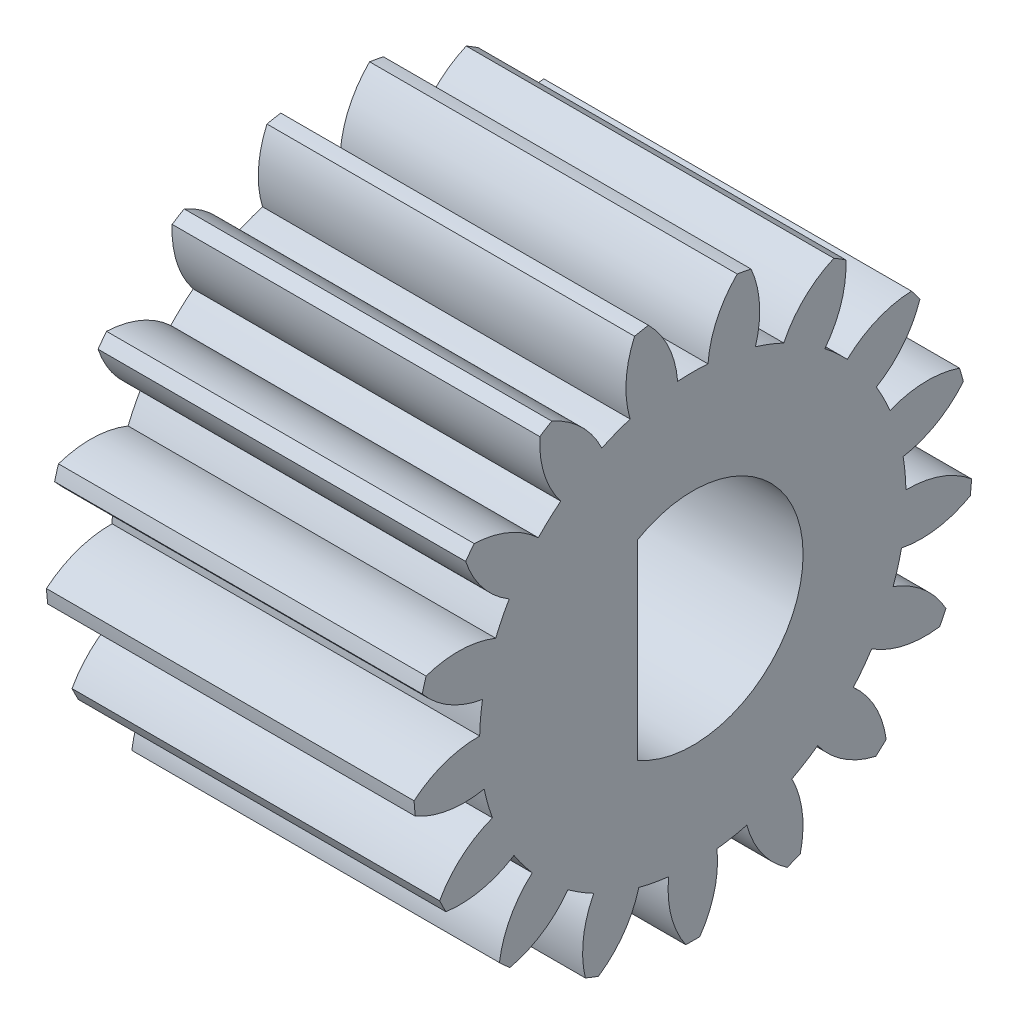
from build123d import *

# Parameters (mm, degrees)
BASPROSKE_W         = 10
BASPROSKE_H         = 7.6
TOOTHCUT_DEPTH      = 15.680599443
TEETHCUTS_COUNT     = 17
TEETHCUTS_ANGLE     = 338.823529412
BORSKE_R            = 3
BORE_DEPTH          = 50.0001016
BOSS_EXTRUDE3_DEPTH = 10


with BuildPart() as part:
    # BasProSke → Base-Revolve (revolve)
    with BuildSketch(Plane(origin=(0, 0, 0), x_dir=(1, 0, 0), z_dir=(0, 1, 0)), mode=Mode.PRIVATE) as base_revolve_sk:
        with Locations((5, 3.8)):
            Rectangle(BASPROSKE_W, BASPROSKE_H)
    revolve(base_revolve_sk.sketch.rotate(Axis((-10, 0, 0), (1, 0, 0)), 180), axis=Axis((-10, 0, 0), (1, 0, 0)))

    # TooCutSke → ToothCut (cut, through all)
    with BuildSketch(Plane(origin=(0, 0, 0), x_dir=(0, 0, -1), z_dir=(1, 0, 0))):
        with BuildLine():
            ThreePointArc((0.412875903, 5.784283403), (0, 5.799), (-0.412875903, 5.784283403))
            ThreePointArc((-0.412875903, 5.784283403), (-0.662486036, 6.729558143), (-1.230208712, 7.525510726))
            ThreePointArc((-1.230208712, 7.525510726), (0, 7.6254), (1.230208712, 7.525510726))
            ThreePointArc((1.230208712, 7.525510726), (0.662486036, 6.729558143), (0.412875903, 5.784283403))
        make_face()
    toothcut = extrude(amount=TOOTHCUT_DEPTH, mode=Mode.SUBTRACT)

    # TeethCuts: ToothCut ×17 about axis
    teethcuts_axis = Axis((-10, 0, 0), (1, 0, 0))
    for i in range(1, TEETHCUTS_COUNT):
        add(toothcut.rotate(teethcuts_axis, i * TEETHCUTS_ANGLE / (TEETHCUTS_COUNT - 1)), mode=Mode.SUBTRACT)

    # BorSke → Bore (cut, symmetric)
    with BuildSketch(Plane(origin=(0, 0, 0), x_dir=(0, 0, -1), z_dir=(1, 0, 0))):
        with Locations(Location((0, 0, 0), (0, 0, 180))):
            Circle(BORSKE_R)
    extrude(amount=BORE_DEPTH, both=True, mode=Mode.SUBTRACT)

    # Sketch1 → Boss-Extrude3 (add)
    with BuildSketch(Plane(origin=(10, 0, 0), x_dir=(0, 0, -1), z_dir=(1, 0, 0))):
        with BuildLine():
            ThreePointArc((-1.5, 2.598076211), (-2.598076211, 1.5), (-3, 0))
            Line((-3, 0), (-1.5, 0))
            Line((-1.5, 0), (-1.5, 2.598076211))
        make_face()
        with BuildLine():
            Line((-1.5, 0), (-3, 0))
            ThreePointArc((-3, 0), (-2.598076211, -1.5), (-1.5, -2.598076211))
            Line((-1.5, -2.598076211), (-1.5, 0))
        make_face()
    extrude(amount=-BOSS_EXTRUDE3_DEPTH)


solid = part.part
